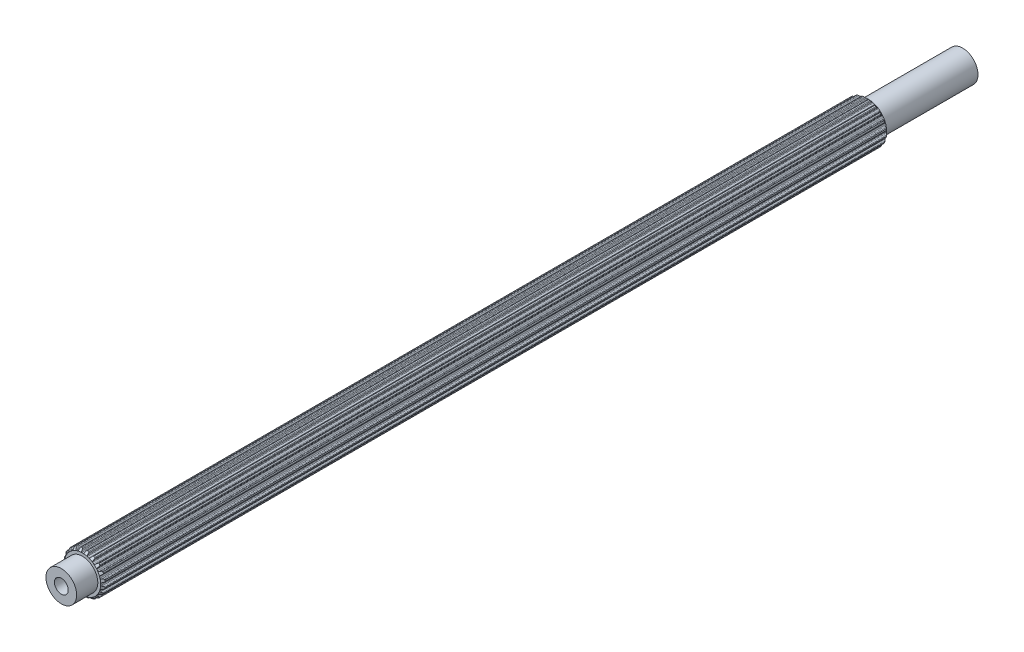
from build123d import *

# Parameters (mm, degrees)
BOSS_EXTRUDE1_DEPTH            = 70.0786
BOSS_EXTRUDE1_DEPTH_BACK       = 58.1406
SKETCH2_R                      = 2.5019
BOSS_EXTRUDE2_DEPTH            = 73.533
CUT_EXTRUDE1_REACH             = 75.683
SKETCH6_R                      = 1.1303
CUT_EXTRUDE1_DIRECTION_2_REACH = 75.683
BOSS_EXTRUDE3_DEPTH            = 64.008
BOSS_EXTRUDE3_DEPTH_BACK       = 64.008
SKETCH7_R                      = 1.1303


with BuildPart() as part:
    # Sketch1 → Boss-Extrude1 (new, two sides: drawn at the far end of the back side and taken through both)
    with BuildSketch(Plane.XY.offset(-BOSS_EXTRUDE1_DEPTH_BACK)):
        with BuildLine():
            Line((-0.106949245, 2.969874934), (0.106949245, 2.969874934))
            ThreePointArc((0.106949245, 2.969874934), (0.196343213, 2.986924176), (0.253739238, 3.057547504))
            Line((0.253739238, 3.057547504), (0.315888147, 3.237526941))
            ThreePointArc((0.315888147, 3.237526941), (0.359032156, 3.298322911), (0.4281449, 3.326269005))
            Line((0.4281449, 3.326269005), (0.620027588, 3.2937547))
            ThreePointArc((0.620027588, 3.2937547), (0.689621142, 3.24802576), (0.718272212, 3.169836791))
            Line((0.718272212, 3.169836791), (0.724389167, 2.979527391))
            ThreePointArc((0.724389167, 2.979527391), (0.750934762, 2.9040661), (0.816027049, 2.857568043))
            Line((0.816027049, 2.857568043), (1.019456602, 2.791469774))
            ThreePointArc((1.019456602, 2.791469774), (1.109743823, 2.780060312), (1.186154496, 2.829490741))
            Line((1.186154496, 2.829490741), (1.300878326, 2.981456288))
            ThreePointArc((1.300878326, 2.981456288), (1.360697704, 3.02594446), (1.435063648, 3.031165762))
            Line((1.435063648, 3.031165762), (1.607507455, 2.940947809))
            ThreePointArc((1.607507455, 2.940947809), (1.659563839, 2.875951412), (1.662650905, 2.792735615))
            Line((1.662650905, 2.792735615), (1.609659636, 2.609850378))
            ThreePointArc((1.609659636, 2.609850378), (1.611587176, 2.529879385), (1.659124931, 2.465542482))
            Line((1.659124931, 2.465542482), (1.832172444, 2.339816104))
            ThreePointArc((1.832172444, 2.339816104), (1.914514976, 2.301064775), (2.002460687, 2.32446371))
            Line((2.002460687, 2.32446371), (2.158529469, 2.433539921))
            ThreePointArc((2.158529469, 2.433539921), (2.229168681, 2.457365482), (2.301508367, 2.439350895))
            Line((2.301508367, 2.439350895), (2.437633293, 2.300260456))
            ThreePointArc((2.437633293, 2.300260456), (2.467056864, 2.222358901), (2.444277744, 2.14226202))
            Line((2.444277744, 2.14226202), (2.337365406, 1.984703026))
            ThreePointArc((2.337365406, 1.984703026), (2.314486209, 1.908050449), (2.339816104, 1.832172444))
            Line((2.339816104, 1.832172444), (2.465542482, 1.659124931))
            ThreePointArc((2.465542482, 1.659124931), (2.531880064, 1.596824985), (2.622752074, 1.591901975))
            Line((2.622752074, 1.591901975), (2.804888709, 1.64741171))
            ThreePointArc((2.804888709, 1.64741171), (2.879433095, 1.648242449), (2.942665411, 1.608755366))
            Line((2.942665411, 1.608755366), (3.0291466, 1.434407582))
            ThreePointArc((3.0291466, 1.434407582), (3.033057175, 1.351226417), (2.986641646, 1.282088892))
            Line((2.986641646, 1.282088892), (2.836273564, 1.165279113))
            ThreePointArc((2.836273564, 1.165279113), (2.790827206, 1.099448241), (2.791469774, 1.019456602))
            Line((2.791469774, 1.019456602), (2.857568043, 0.816027049))
            ThreePointArc((2.857568043, 0.816027049), (2.901407091, 0.736276839), (2.986310214, 0.703513784))
            Line((2.986310214, 0.703513784), (3.1766859, 0.700023363))
            ThreePointArc((3.1766859, 0.700023363), (3.247838536, 0.677777961), (3.295773863, 0.620683653))
            Line((3.295773863, 0.620683653), (3.324145932, 0.4281449))
            ThreePointArc((3.324145932, 0.4281449), (3.302160717, 0.347826477), (3.236652255, 0.29641597))
            Line((3.236652255, 0.29641597), (3.057547504, 0.231789562))
            ThreePointArc((3.057547504, 0.231789562), (2.993982591, 0.183224379), (2.969874934, 0.106949245))
            Line((2.969874934, 0.106949245), (2.969874934, -0.106949245))
            ThreePointArc((2.969874934, -0.106949245), (2.986924176, -0.196343213), (3.057547504, -0.253739238))
            Line((3.057547504, -0.253739238), (3.237526941, -0.315888147))
            ThreePointArc((3.237526941, -0.315888147), (3.298322911, -0.359032156), (3.326269005, -0.4281449))
            Line((3.326269005, -0.4281449), (3.2937547, -0.620027588))
            ThreePointArc((3.2937547, -0.620027588), (3.24802576, -0.689621142), (3.169836791, -0.718272212))
            Line((3.169836791, -0.718272212), (2.979527391, -0.724389167))
            ThreePointArc((2.979527391, -0.724389167), (2.9040661, -0.750934762), (2.857568043, -0.816027049))
            Line((2.857568043, -0.816027049), (2.791469774, -1.019456602))
            ThreePointArc((2.791469774, -1.019456602), (2.780060312, -1.109743823), (2.829490741, -1.186154496))
            Line((2.829490741, -1.186154496), (2.981456288, -1.300878326))
            ThreePointArc((2.981456288, -1.300878326), (3.02594446, -1.360697704), (3.031165762, -1.435063648))
            Line((3.031165762, -1.435063648), (2.940947809, -1.607507455))
            ThreePointArc((2.940947809, -1.607507455), (2.875951412, -1.659563839), (2.792735615, -1.662650905))
            Line((2.792735615, -1.662650905), (2.609850378, -1.609659636))
            ThreePointArc((2.609850378, -1.609659636), (2.529879385, -1.611587176), (2.465542482, -1.659124931))
            Line((2.465542482, -1.659124931), (2.339816104, -1.832172444))
            ThreePointArc((2.339816104, -1.832172444), (2.301064775, -1.914514976), (2.32446371, -2.002460687))
            Line((2.32446371, -2.002460687), (2.433539921, -2.158529469))
            ThreePointArc((2.433539921, -2.158529469), (2.457365482, -2.229168681), (2.439350895, -2.301508367))
            Line((2.439350895, -2.301508367), (2.300260456, -2.437633293))
            ThreePointArc((2.300260456, -2.437633293), (2.222358901, -2.467056864), (2.14226202, -2.444277744))
            Line((2.14226202, -2.444277744), (1.984703026, -2.337365406))
            ThreePointArc((1.984703026, -2.337365406), (1.908050449, -2.314486209), (1.832172444, -2.339816104))
            Line((1.832172444, -2.339816104), (1.659124931, -2.465542482))
            ThreePointArc((1.659124931, -2.465542482), (1.596824985, -2.531880064), (1.591901975, -2.622752074))
            Line((1.591901975, -2.622752074), (1.64741171, -2.804888709))
            ThreePointArc((1.64741171, -2.804888709), (1.648242449, -2.879433095), (1.608755366, -2.942665411))
            Line((1.608755366, -2.942665411), (1.434407582, -3.0291466))
            ThreePointArc((1.434407582, -3.0291466), (1.351226417, -3.033057175), (1.282088892, -2.986641646))
            Line((1.282088892, -2.986641646), (1.165279113, -2.836273564))
            ThreePointArc((1.165279113, -2.836273564), (1.099448241, -2.790827206), (1.019456602, -2.791469774))
            Line((1.019456602, -2.791469774), (0.816027049, -2.857568043))
            ThreePointArc((0.816027049, -2.857568043), (0.736276839, -2.901407091), (0.703513784, -2.986310214))
            Line((0.703513784, -2.986310214), (0.700023363, -3.1766859))
            ThreePointArc((0.700023363, -3.1766859), (0.677777961, -3.247838536), (0.620683653, -3.295773863))
            Line((0.620683653, -3.295773863), (0.4281449, -3.324145932))
            ThreePointArc((0.4281449, -3.324145932), (0.347826477, -3.302160717), (0.29641597, -3.236652255))
            Line((0.29641597, -3.236652255), (0.231789562, -3.057547504))
            ThreePointArc((0.231789562, -3.057547504), (0.183224379, -2.993982591), (0.106949245, -2.969874934))
            Line((0.106949245, -2.969874934), (-0.106949245, -2.969874934))
            ThreePointArc((-0.106949245, -2.969874934), (-0.196343213, -2.986924176), (-0.253739238, -3.057547504))
            Line((-0.253739238, -3.057547504), (-0.315888147, -3.237526941))
            ThreePointArc((-0.315888147, -3.237526941), (-0.359032156, -3.298322911), (-0.4281449, -3.326269005))
            Line((-0.4281449, -3.326269005), (-0.620027588, -3.2937547))
            ThreePointArc((-0.620027588, -3.2937547), (-0.689621142, -3.24802576), (-0.718272212, -3.169836791))
            Line((-0.718272212, -3.169836791), (-0.724389167, -2.979527391))
            ThreePointArc((-0.724389167, -2.979527391), (-0.750934762, -2.9040661), (-0.816027049, -2.857568043))
            Line((-0.816027049, -2.857568043), (-1.019456602, -2.791469774))
            ThreePointArc((-1.019456602, -2.791469774), (-1.109743823, -2.780060312), (-1.186154496, -2.829490741))
            Line((-1.186154496, -2.829490741), (-1.300878326, -2.981456288))
            ThreePointArc((-1.300878326, -2.981456288), (-1.360697704, -3.02594446), (-1.435063648, -3.031165762))
            Line((-1.435063648, -3.031165762), (-1.607507455, -2.940947809))
            ThreePointArc((-1.607507455, -2.940947809), (-1.659563839, -2.875951412), (-1.662650905, -2.792735615))
            Line((-1.662650905, -2.792735615), (-1.609659636, -2.609850378))
            ThreePointArc((-1.609659636, -2.609850378), (-1.611587176, -2.529879385), (-1.659124931, -2.465542482))
            Line((-1.659124931, -2.465542482), (-1.832172444, -2.339816104))
            ThreePointArc((-1.832172444, -2.339816104), (-1.914514976, -2.301064775), (-2.002460687, -2.32446371))
            Line((-2.002460687, -2.32446371), (-2.158529469, -2.433539921))
            ThreePointArc((-2.158529469, -2.433539921), (-2.229168681, -2.457365482), (-2.301508367, -2.439350895))
            Line((-2.301508367, -2.439350895), (-2.437633293, -2.300260456))
            ThreePointArc((-2.437633293, -2.300260456), (-2.467056864, -2.222358901), (-2.444277744, -2.14226202))
            Line((-2.444277744, -2.14226202), (-2.337365406, -1.984703026))
            ThreePointArc((-2.337365406, -1.984703026), (-2.314486209, -1.908050449), (-2.339816104, -1.832172444))
            Line((-2.339816104, -1.832172444), (-2.465542482, -1.659124931))
            ThreePointArc((-2.465542482, -1.659124931), (-2.531880064, -1.596824985), (-2.622752074, -1.591901975))
            Line((-2.622752074, -1.591901975), (-2.804888709, -1.64741171))
            ThreePointArc((-2.804888709, -1.64741171), (-2.879433095, -1.648242449), (-2.942665411, -1.608755366))
            Line((-2.942665411, -1.608755366), (-3.0291466, -1.434407582))
            ThreePointArc((-3.0291466, -1.434407582), (-3.033057175, -1.351226417), (-2.986641646, -1.282088892))
            Line((-2.986641646, -1.282088892), (-2.836273564, -1.165279113))
            ThreePointArc((-2.836273564, -1.165279113), (-2.790827206, -1.099448241), (-2.791469774, -1.019456602))
            Line((-2.791469774, -1.019456602), (-2.857568043, -0.816027049))
            ThreePointArc((-2.857568043, -0.816027049), (-2.901407091, -0.736276839), (-2.986310214, -0.703513784))
            Line((-2.986310214, -0.703513784), (-3.1766859, -0.700023363))
            ThreePointArc((-3.1766859, -0.700023363), (-3.247838536, -0.677777961), (-3.295773863, -0.620683653))
            Line((-3.295773863, -0.620683653), (-3.324145932, -0.4281449))
            ThreePointArc((-3.324145932, -0.4281449), (-3.302160717, -0.347826477), (-3.236652255, -0.29641597))
            Line((-3.236652255, -0.29641597), (-3.057547504, -0.231789562))
            ThreePointArc((-3.057547504, -0.231789562), (-2.993982591, -0.183224379), (-2.969874934, -0.106949245))
            Line((-2.969874934, -0.106949245), (-2.969874934, 0.106949245))
            ThreePointArc((-2.969874934, 0.106949245), (-2.986924176, 0.196343213), (-3.057547504, 0.253739238))
            Line((-3.057547504, 0.253739238), (-3.237526941, 0.315888147))
            ThreePointArc((-3.237526941, 0.315888147), (-3.298322911, 0.359032156), (-3.326269005, 0.4281449))
            Line((-3.326269005, 0.4281449), (-3.2937547, 0.620027588))
            ThreePointArc((-3.2937547, 0.620027588), (-3.24802576, 0.689621142), (-3.169836791, 0.718272212))
            Line((-3.169836791, 0.718272212), (-2.979527391, 0.724389167))
            ThreePointArc((-2.979527391, 0.724389167), (-2.9040661, 0.750934762), (-2.857568043, 0.816027049))
            Line((-2.857568043, 0.816027049), (-2.791469774, 1.019456602))
            ThreePointArc((-2.791469774, 1.019456602), (-2.780060312, 1.109743823), (-2.829490741, 1.186154496))
            Line((-2.829490741, 1.186154496), (-2.981456288, 1.300878326))
            ThreePointArc((-2.981456288, 1.300878326), (-3.02594446, 1.360697704), (-3.031165762, 1.435063648))
            Line((-3.031165762, 1.435063648), (-2.940947809, 1.607507455))
            ThreePointArc((-2.940947809, 1.607507455), (-2.875951412, 1.659563839), (-2.792735615, 1.662650905))
            Line((-2.792735615, 1.662650905), (-2.609850378, 1.609659636))
            ThreePointArc((-2.609850378, 1.609659636), (-2.529879385, 1.611587176), (-2.465542482, 1.659124931))
            Line((-2.465542482, 1.659124931), (-2.339816104, 1.832172444))
            ThreePointArc((-2.339816104, 1.832172444), (-2.301064775, 1.914514976), (-2.32446371, 2.002460687))
            Line((-2.32446371, 2.002460687), (-2.433539921, 2.158529469))
            ThreePointArc((-2.433539921, 2.158529469), (-2.457365482, 2.229168681), (-2.439350895, 2.301508367))
            Line((-2.439350895, 2.301508367), (-2.300260456, 2.437633293))
            ThreePointArc((-2.300260456, 2.437633293), (-2.222358901, 2.467056864), (-2.14226202, 2.444277744))
            Line((-2.14226202, 2.444277744), (-1.984703026, 2.337365406))
            ThreePointArc((-1.984703026, 2.337365406), (-1.908050449, 2.314486209), (-1.832172444, 2.339816104))
            Line((-1.832172444, 2.339816104), (-1.659124931, 2.465542482))
            ThreePointArc((-1.659124931, 2.465542482), (-1.596824985, 2.531880064), (-1.591901975, 2.622752074))
            Line((-1.591901975, 2.622752074), (-1.64741171, 2.804888709))
            ThreePointArc((-1.64741171, 2.804888709), (-1.648242449, 2.879433095), (-1.608755366, 2.942665411))
            Line((-1.608755366, 2.942665411), (-1.434407582, 3.0291466))
            ThreePointArc((-1.434407582, 3.0291466), (-1.351226417, 3.033057175), (-1.282088892, 2.986641646))
            Line((-1.282088892, 2.986641646), (-1.165279113, 2.836273564))
            ThreePointArc((-1.165279113, 2.836273564), (-1.099448241, 2.790827206), (-1.019456602, 2.791469774))
            Line((-1.019456602, 2.791469774), (-0.816027049, 2.857568043))
            ThreePointArc((-0.816027049, 2.857568043), (-0.736276839, 2.901407091), (-0.703513784, 2.986310214))
            Line((-0.703513784, 2.986310214), (-0.700023363, 3.1766859))
            ThreePointArc((-0.700023363, 3.1766859), (-0.677777961, 3.247838536), (-0.620683653, 3.295773863))
            Line((-0.620683653, 3.295773863), (-0.4281449, 3.324145932))
            ThreePointArc((-0.4281449, 3.324145932), (-0.347826477, 3.302160717), (-0.29641597, 3.236652255))
            Line((-0.29641597, 3.236652255), (-0.231789562, 3.057547504))
            ThreePointArc((-0.231789562, 3.057547504), (-0.183224379, 2.993982591), (-0.106949245, 2.969874934))
        make_face()
    extrude(amount=BOSS_EXTRUDE1_DEPTH + BOSS_EXTRUDE1_DEPTH_BACK)

    # Sketch2 → Boss-Extrude2 (add, symmetric)
    with BuildSketch(Plane.XY):
        Circle(SKETCH2_R)
    extrude(amount=BOSS_EXTRUDE2_DEPTH, both=True)

    # Sketch3 → Cut-Revolve1 (revolve, cut)
    with BuildSketch(Plane(origin=(0, 0, 0), x_dir=(0, 0, -1), z_dir=(1, 0, 0))):
        Polygon((-68.947375505, 4.101099429), (-70.0786, 2.969874934), (-70.0786, 4.101099429), align=None)
        Polygon((58.1406, 54.854469155), (58.1406, 2.969874934), (32.198302889, 28.912172045), align=None)
    revolve(axis=Axis((0, 0, 14.360793934), (0, 0, -1)), mode=Mode.SUBTRACT)

    # Cut-Extrude1: up to this face of the body (flat: up to its plane)
    cut_extrude1_end = Plane(part.part.faces().sort_by_distance((0, 0, 73.533))[0])
    # Sketch6 → Cut-Extrude1 (cut, up to the picked face)
    with BuildSketch(Plane.XY, mode=Mode.PRIVATE) as cut_extrude1_sk1:
        Circle(SKETCH6_R)
    cut_extrude1_tool1 = split(extrude(cut_extrude1_sk1.sketch, amount=CUT_EXTRUDE1_REACH, mode=Mode.PRIVATE), bisect_by=cut_extrude1_end, keep=Keep.BOTH, mode=Mode.PRIVATE)
    add(cut_extrude1_tool1.solids().sort_by(Axis((0, 0, 0), (0, 0, 1)))[0], mode=Mode.SUBTRACT)

    # Cut-Extrude1 direction 2: up to this face of the body (flat: up to its plane)
    cut_extrude1_direction_2_end = Plane(part.part.faces().sort_by_distance((0, 0, -73.533))[0])
    # Sketch6 → Cut-Extrude1 direction 2 (cut, up to the picked face)
    with BuildSketch(Plane.XY, mode=Mode.PRIVATE) as cut_extrude1_direction_2_sk1:
        Circle(SKETCH6_R)
    cut_extrude1_direction_2_tool1 = split(extrude(cut_extrude1_direction_2_sk1.sketch, amount=-CUT_EXTRUDE1_DIRECTION_2_REACH, mode=Mode.PRIVATE), bisect_by=cut_extrude1_direction_2_end, keep=Keep.BOTH, mode=Mode.PRIVATE)
    add(cut_extrude1_direction_2_tool1.solids().sort_by(Axis((0, 0, 0), (0, 0, -1)))[0], mode=Mode.SUBTRACT)

    # Sketch7 → Boss-Extrude3 (add, two sides: drawn at the far end of the back side and taken through both)
    with BuildSketch(Plane.XY.offset(-BOSS_EXTRUDE3_DEPTH_BACK)):
        Circle(SKETCH7_R)
    extrude(amount=BOSS_EXTRUDE3_DEPTH + BOSS_EXTRUDE3_DEPTH_BACK)


solid = part.part
